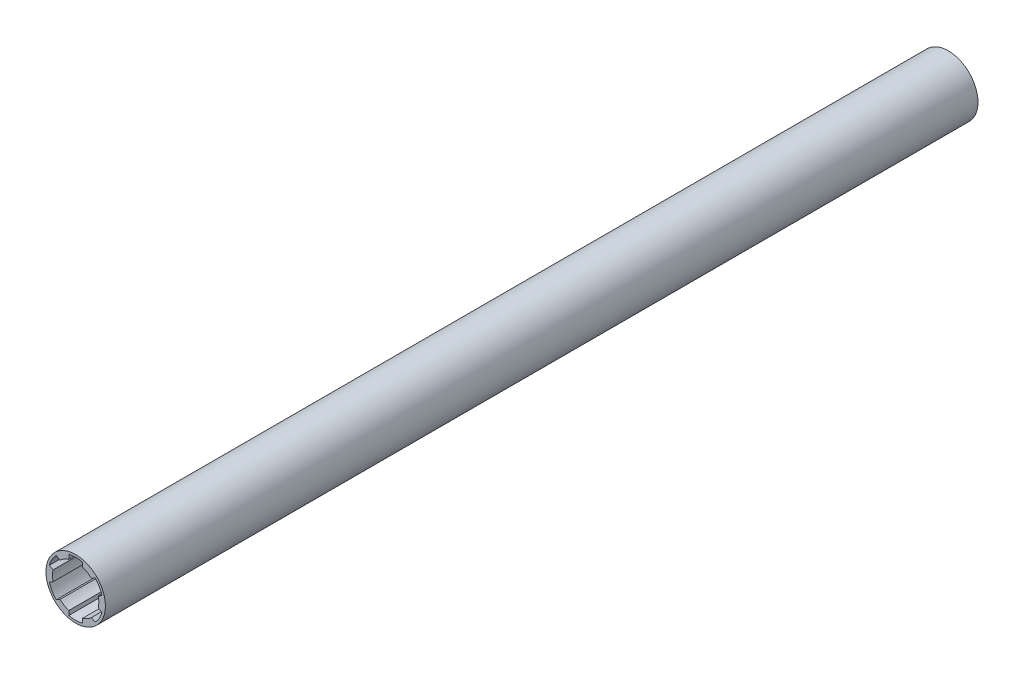
from build123d import *

# Parameters (mm, degrees)
SKETCH1_R           = 19.04
BOSS_EXTRUDE1_DEPTH = 558.8


with BuildPart() as part:
    # Sketch1 → Boss-Extrude1 (new body)
    with BuildSketch(Plane.XY):
        Circle(SKETCH1_R)
        with BuildLine():
            Line((10.08336557, 10.867675179), (12.467953414, 12.244417612))
            ThreePointArc((12.467953414, 12.244417612), (15.133793931, 8.7375), (16.837953414, 4.675355583))
            Line((16.837953414, 4.675355583), (14.45336557, 3.29861315))
            ThreePointArc((14.45336557, 3.29861315), (14.825, 0), (14.45336557, -3.29861315))
            Line((14.45336557, -3.29861315), (16.837953414, -4.675355583))
            ThreePointArc((16.837953414, -4.675355583), (15.133793931, -8.7375), (12.467953414, -12.244417612))
            Line((12.467953414, -12.244417612), (10.08336557, -10.867675179))
            ThreePointArc((10.08336557, -10.867675179), (7.4125, -12.838826611), (4.37, -14.166288328))
            Line((4.37, -14.166288328), (4.37, -16.919773196))
            ThreePointArc((4.37, -16.919773196), (0, -17.475), (-4.37, -16.919773196))
            Line((-4.37, -16.919773196), (-4.37, -14.166288328))
            ThreePointArc((-4.37, -14.166288328), (-7.4125, -12.838826611), (-10.08336557, -10.867675179))
            Line((-10.08336557, -10.867675179), (-12.467953414, -12.244417612))
            ThreePointArc((-12.467953414, -12.244417612), (-15.133793931, -8.7375), (-16.837953414, -4.675355583))
            Line((-16.837953414, -4.675355583), (-14.45336557, -3.29861315))
            ThreePointArc((-14.45336557, -3.29861315), (-14.825, 0), (-14.45336557, 3.29861315))
            Line((-14.45336557, 3.29861315), (-16.837953414, 4.675355583))
            ThreePointArc((-16.837953414, 4.675355583), (-15.133793931, 8.7375), (-12.467953414, 12.244417612))
            Line((-12.467953414, 12.244417612), (-10.08336557, 10.867675179))
            ThreePointArc((-10.08336557, 10.867675179), (-7.4125, 12.838826611), (-4.37, 14.166288328))
            Line((-4.37, 14.166288328), (-4.37, 16.919773196))
            ThreePointArc((-4.37, 16.919773196), (0, 17.475), (4.37, 16.919773196))
            Line((4.37, 16.919773196), (4.37, 14.166288328))
            ThreePointArc((4.37, 14.166288328), (7.4125, 12.838826611), (10.08336557, 10.867675179))
        make_face(mode=Mode.SUBTRACT)
    extrude(amount=BOSS_EXTRUDE1_DEPTH)


solid = part.part
